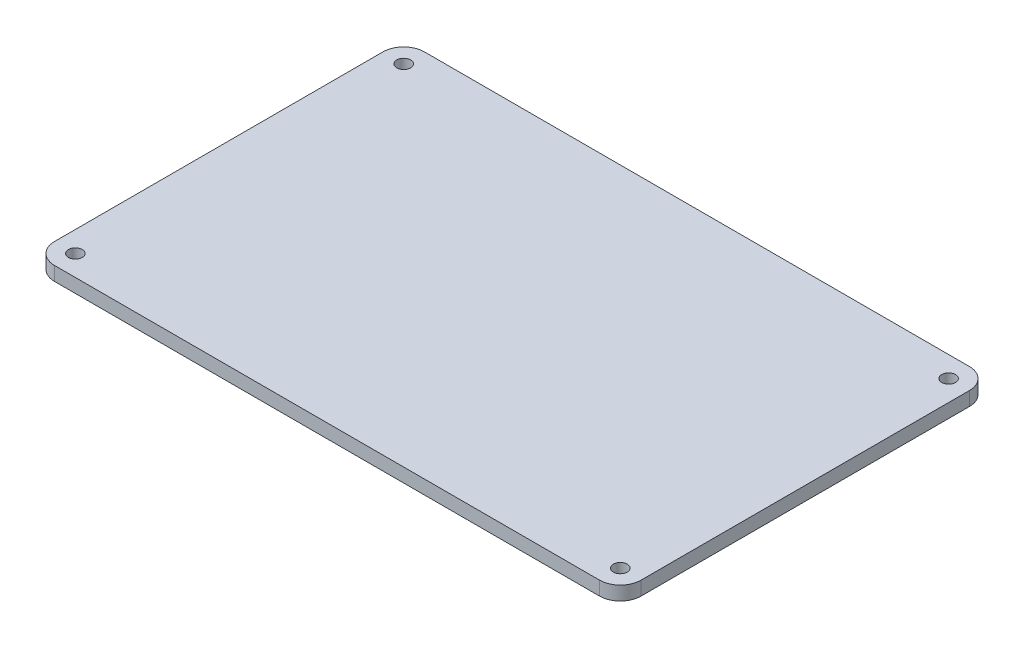
from build123d import *

# Parameters (mm, degrees)
SKETCH1_R           = 1.5
BOSS_EXTRUDE1_DEPTH = 3


with BuildPart() as part:
    # Sketch1 → Boss-Extrude1 (new body)
    with BuildSketch(Plane(origin=(0, 0, 0), x_dir=(1, 0, 0), z_dir=(0, 1, 0))):
        with BuildLine():
            Line((-66.609472998, -5.271283686), (-66.609472998, 65.828716314))
            ThreePointArc((-66.609472998, 65.828716314), (-65.291453513, 69.010696829), (-62.109472998, 70.328716314))
            Line((-62.109472998, 70.328716314), (55.890527002, 70.328716314))
            ThreePointArc((55.890527002, 70.328716314), (59.072507518, 69.010696829), (60.390527002, 65.828716314))
            Line((60.390527002, 65.828716314), (60.390527002, -5.271283686))
            ThreePointArc((60.390527002, -5.271283686), (59.072507518, -8.453264201), (55.890527002, -9.771283686))
            Line((55.890527002, -9.771283686), (-62.109472998, -9.771283686))
            ThreePointArc((-62.109472998, -9.771283686), (-65.291453513, -8.453264201), (-66.609472998, -5.271283686))
        make_face()
        with Locations(Location((-62.109472998, 65.828716314, 0), (0, 0, 270))):
            Circle(SKETCH1_R, mode=Mode.SUBTRACT)
        with Locations(Location((55.890527002, 65.828716314, 0), (0, 0, 270))):
            Circle(SKETCH1_R, mode=Mode.SUBTRACT)
        with Locations(Location((-62.109472998, -5.271283686, 0), (0, 0, 270))):
            Circle(SKETCH1_R, mode=Mode.SUBTRACT)
        with Locations(Location((55.890527002, -5.271283686, 0), (0, 0, 270))):
            Circle(SKETCH1_R, mode=Mode.SUBTRACT)
    extrude(amount=BOSS_EXTRUDE1_DEPTH)


solid = part.part
